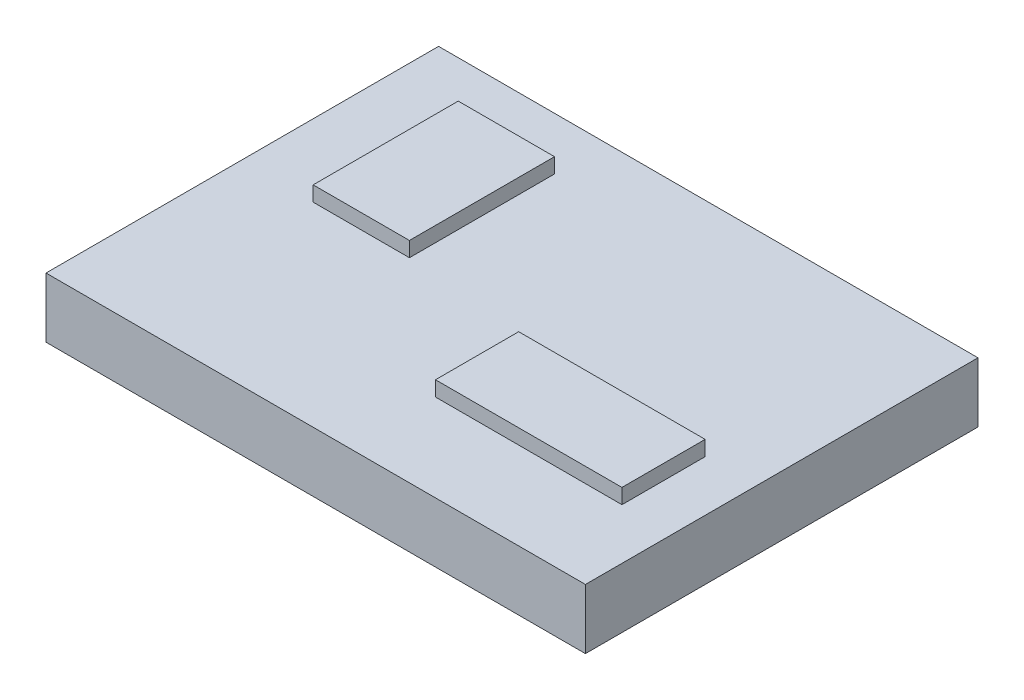
from build123d import *

# Parameters (mm, degrees)
SKETCH1_W           = 18
SKETCH1_H           = 13.1
BOSS_EXTRUDE1_DEPTH = 2
SKETCH2_W           = 3.212723326
SKETCH2_H           = 4.841010911
SKETCH2_W_2         = 6.22211932
SKETCH2_H_2         = 2.776214037
BOSS_EXTRUDE2_DEPTH = 0.5


with BuildPart() as part:
    # Sketch1 → Boss-Extrude1 (new body)
    with BuildSketch(Plane(origin=(0, 0, 0), x_dir=(1, 0, 0), z_dir=(0, 1, 0))):
        with Locations((9, 6.55)):
            Rectangle(SKETCH1_W, SKETCH1_H)
    extrude(amount=BOSS_EXTRUDE1_DEPTH)

    # Sketch2 → Boss-Extrude2 (add)
    with BuildSketch(Plane(origin=(0, 2, 0), x_dir=(1, 0, 0), z_dir=(0, 1, 0))):
        with Locations((4.016157197, 8.925346003)):
            Rectangle(SKETCH2_W, SKETCH2_H)
        with Locations((13.193985763, 4.302170731)):
            Rectangle(SKETCH2_W_2, SKETCH2_H_2)
    extrude(amount=BOSS_EXTRUDE2_DEPTH)


solid = part.part
